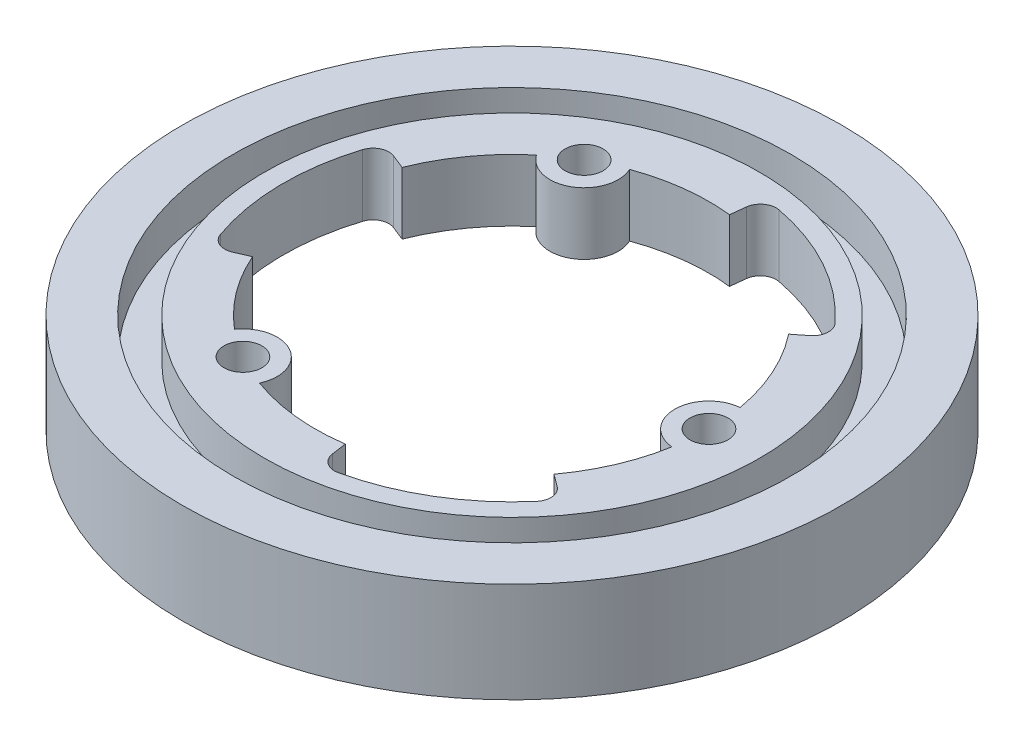
from build123d import *

# Parameters (mm, degrees)
SKETCH1_R           = 19.54
SKETCH1_R_2         = 15.54
BOSS_EXTRUDE1_DEPTH = 7.9
SKETCH1_3_R         = 2.7
BOSS_EXTRUDE2_DEPTH = 7.9
SKETCH1_4_R         = 1.5
CUT_EXTRUDE1_DEPTH  = 29.740793308
CUT_EXTRUDE2_DEPTH  = 29.740793308
SKETCH1_6_R         = 1.5
CUT_EXTRUDE5_DEPTH  = 3
CIRPATTERN1_COUNT   = 3
SKETCH2_R           = 26
SKETCH2_R_2         = 19.54
BOSS_EXTRUDE3_DEPTH = 7.9
CUT_EXTRUDE4_START  = 7.9
SKETCH2_3_R         = 22
SKETCH2_3_R_2       = 19.54
CUT_EXTRUDE4_DEPTH  = 3.14
CUT_EXTRUDE6_START  = 3
SKETCH2_4_R         = 22
CUT_EXTRUDE6_DEPTH  = 3


with BuildPart() as part:
    # Sketch1 → Boss-Extrude1 (new body)
    with BuildSketch(Plane(origin=(0, 0, 0), x_dir=(1, 0, 0), z_dir=(0, 1, 0))):
        with Locations(Location((0, 0, 0), (0, 0, 270))):
            Circle(SKETCH1_R)
        with Locations(Location((0, 0, 0), (0, 0, 270))):
            Circle(SKETCH1_R_2, mode=Mode.SUBTRACT)
    extrude(amount=BOSS_EXTRUDE1_DEPTH)

    # Sketch1<3> → Boss-Extrude2 (add)
    with BuildSketch(Plane(origin=(0, 0, 0), x_dir=(1, 0, 0), z_dir=(0, 1, 0))):
        with Locations((15.54, 0)):
            Circle(SKETCH1_3_R)
    boss_extrude2 = extrude(amount=BOSS_EXTRUDE2_DEPTH)

    # Sketch1<4> → Cut-Extrude1 (cut, symmetric)
    with BuildSketch(Plane(origin=(0, 0, 0), x_dir=(1, 0, 0), z_dir=(0, 1, 0))):
        with Locations(Location((15.54, 0, 0), (0, 0, 270))):
            Circle(SKETCH1_4_R)
    cut_extrude1 = extrude(amount=CUT_EXTRUDE1_DEPTH, both=True, mode=Mode.SUBTRACT)

    # Sketch1<5> → Cut-Extrude2 (cut, symmetric)
    with BuildSketch(Plane(origin=(0, 0, 0), x_dir=(1, 0, 0), z_dir=(0, 1, 0))):
        with BuildLine():
            Line((1.84893352, 16.641004923), (1.716044464, 15.444960065))
            ThreePointArc((1.716044464, 15.444960065), (7.546281877, 13.584742538), (12.206193142, 9.617715372))
            Line((12.206193142, 9.617715372), (13.151430585, 10.362503249))
            ThreePointArc((13.151430585, 10.362503249), (13.623726964, 11.24345363), (13.299320972, 12.188915525))
            ThreePointArc((13.299320972, 12.188915525), (8.760291222, 15.770190161), (3.321432407, 17.731601359))
            ThreePointArc((3.321432407, 17.731601359), (2.347317501, 17.507463762), (1.84893352, 16.641004923))
        make_face()
    cut_extrude2 = extrude(amount=CUT_EXTRUDE2_DEPTH, both=True, mode=Mode.SUBTRACT)

    # Sketch1<6> → Cut-Extrude5 (cut)
    with BuildSketch(Plane(origin=(0, 0, 0), x_dir=(1, 0, 0), z_dir=(0, 1, 0))):
        with BuildLine():
            Line((13.541549805, -7.623518144), (14.590196156, -8.213877046))
            ThreePointArc((14.590196156, -8.213877046), (15.584628409, -8.315079224), (16.335293585, -7.655049543))
            ThreePointArc((16.335293585, -7.655049543), (17.48108114, -4.455715676), (18.006537967, -1.098267026))
            ThreePointArc((18.006537967, -1.098267026), (18.24, 0), (18.006537967, 1.098267026))
            ThreePointArc((18.006537967, 1.098267026), (17.48108114, 4.455715676), (16.335293585, 7.655049543))
            ThreePointArc((16.335293585, 7.655049543), (15.584628409, 8.315079224), (14.590196156, 8.213877046))
            Line((14.590196156, 8.213877046), (13.541549805, 7.623518144))
            ThreePointArc((13.541549805, 7.623518144), (14.632931196, 5.231531765), (15.305444015, 2.689792462))
            ThreePointArc((15.305444015, 2.689792462), (12.84, 0), (15.305444015, -2.689792462))
            ThreePointArc((15.305444015, -2.689792462), (14.632931196, -5.231531765), (13.541549805, -7.623518144))
        make_face()
        with Locations(Location((15.54, 0, 0), (0, 0, 270))):
            Circle(SKETCH1_6_R, mode=Mode.SUBTRACT)
    cut_extrude5 = extrude(amount=CUT_EXTRUDE5_DEPTH, mode=Mode.SUBTRACT)

    # CirPattern1: Boss-Extrude2, Cut-Extrude1, Cut-Extrude2, Cut-Extrude5 ×3 about axis
    cirpattern1_axis = Axis((0, 0, 0), (0, 1, 0))
    add([boss_extrude2.rotate(cirpattern1_axis, i * 360 / CIRPATTERN1_COUNT) for i in range(1, CIRPATTERN1_COUNT)])
    add([cut_extrude1.rotate(cirpattern1_axis, i * 360 / CIRPATTERN1_COUNT) for i in range(1, CIRPATTERN1_COUNT)], mode=Mode.SUBTRACT)
    add([cut_extrude2.rotate(cirpattern1_axis, i * 360 / CIRPATTERN1_COUNT) for i in range(1, CIRPATTERN1_COUNT)], mode=Mode.SUBTRACT)
    add([cut_extrude5.rotate(cirpattern1_axis, i * 360 / CIRPATTERN1_COUNT) for i in range(1, CIRPATTERN1_COUNT)], mode=Mode.SUBTRACT)

    # Sketch2 → Boss-Extrude3 (add)
    with BuildSketch(Plane(origin=(0, 0, 0), x_dir=(1, 0, 0), z_dir=(0, 1, 0))):
        with Locations(Location((0, 0, 0), (0, 0, 270))):
            Circle(SKETCH2_R)
        Circle(SKETCH2_R_2, mode=Mode.SUBTRACT)
    extrude(amount=BOSS_EXTRUDE3_DEPTH)

    # Sketch2<3> → Cut-Extrude4 (cut)
    with BuildSketch(Plane(origin=(0, 0, 0), x_dir=(1, 0, 0), z_dir=(0, 1, 0)).offset(CUT_EXTRUDE4_START)):
        with Locations(Location((0, 0, 0), (0, 0, 270))):
            Circle(SKETCH2_3_R)
        with Locations(Location((0, 0, 0), (0, 0, 270))):
            Circle(SKETCH2_3_R_2, mode=Mode.SUBTRACT)
    extrude(amount=-CUT_EXTRUDE4_DEPTH, mode=Mode.SUBTRACT)

    # Sketch2<4> → Cut-Extrude6 (cut)
    with BuildSketch(Plane(origin=(0, 0, 0), x_dir=(1, 0, 0), z_dir=(0, 1, 0)).offset(CUT_EXTRUDE6_START)):
        with Locations(Location((0, 0, 0), (0, 0, 270))):
            Circle(SKETCH2_4_R)
    extrude(amount=-CUT_EXTRUDE6_DEPTH, mode=Mode.SUBTRACT)


solid = part.part
